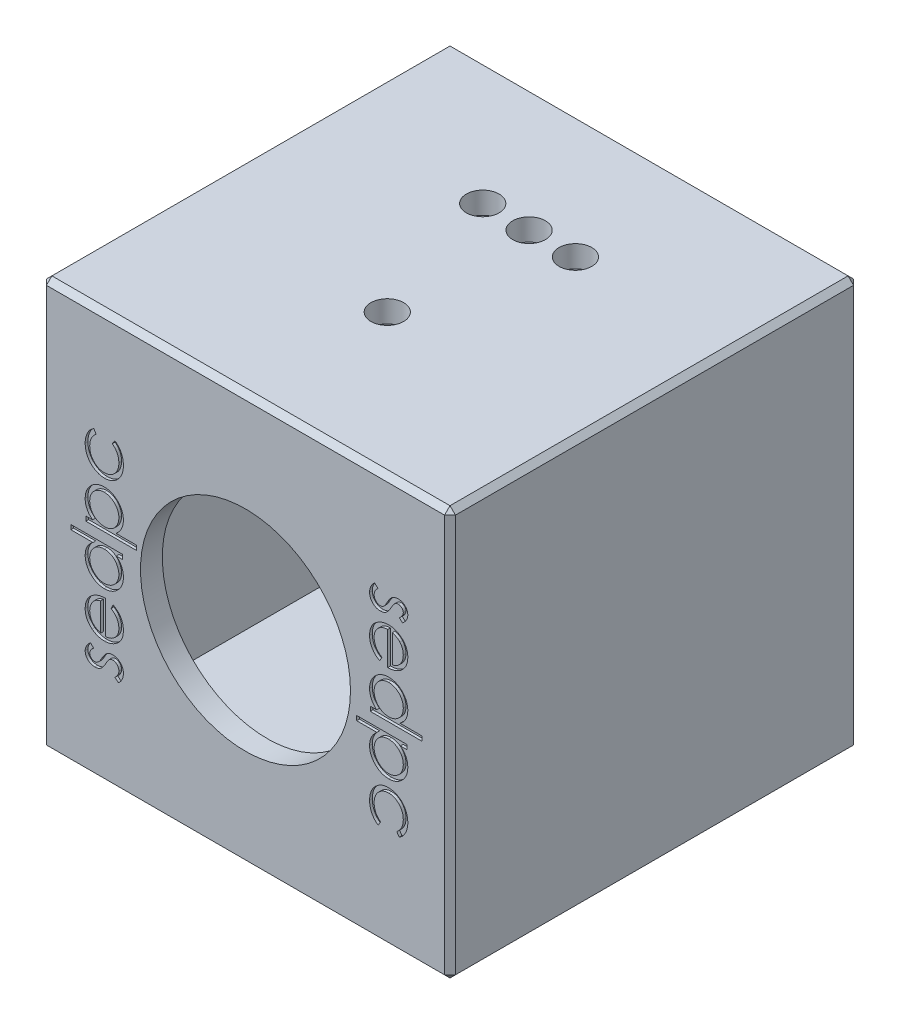
from build123d import *

# Parameters (mm, degrees)
CROQUIS1_W              = 1500
CROQUIS1_H              = 1500
CROQUIS1_W_2            = 1340
CROQUIS1_H_2            = 1340
SALIENTE_EXTRUIR2_DEPTH = 1420
CROQUIS2_W              = 1500
CROQUIS2_H              = 1500
SALIENTE_EXTRUIR3_DEPTH = 80
CROQUIS3_W              = 300
CROQUIS3_H              = 300
CORTAR_EXTRUIR1_DEPTH   = 80
CROQUIS4_W              = 1500
CROQUIS4_H              = 1500
CROQUIS4_R              = 385
SALIENTE_EXTRUIR4_DEPTH = 80
CORTAR_EXTRUIR2_REACH   = 2252
CROQUIS5_R              = 60
CHAFL_N1_SIZE           = 20
CORTAR_EXTRUIR3_DEPTH   = 10
CORTAR_EXTRUIR4_DEPTH   = 10


with BuildPart() as part:
    # Croquis1 → Saliente-Extruir2 (new body)
    with BuildSketch(Plane.XY):
        Rectangle(CROQUIS1_W, CROQUIS1_H)
        Rectangle(CROQUIS1_W_2, CROQUIS1_H_2, mode=Mode.SUBTRACT)
    extrude(amount=SALIENTE_EXTRUIR2_DEPTH)

    # Croquis2 → Saliente-Extruir3 (add)
    with BuildSketch(Plane(origin=(0, 0, 0), x_dir=(-1, 0, 0), z_dir=(0, 0, -1))):
        Rectangle(CROQUIS2_W, CROQUIS2_H)
    extrude(amount=-SALIENTE_EXTRUIR3_DEPTH)

    # Croquis3 → Cortar-Extruir1 (cut)
    with BuildSketch(Plane(origin=(0, 0, 0), x_dir=(-1, 0, 0), z_dir=(0, 0, -1))):
        Rectangle(CROQUIS3_W, CROQUIS3_H)
    extrude(amount=-CORTAR_EXTRUIR1_DEPTH, mode=Mode.SUBTRACT)

    # Croquis4 → Saliente-Extruir4 (add)
    with BuildSketch(Plane.XY.offset(1420)):
        Rectangle(CROQUIS4_W, CROQUIS4_H)
        Circle(CROQUIS4_R, mode=Mode.SUBTRACT)
    extrude(amount=SALIENTE_EXTRUIR4_DEPTH)

    # Cortar-Extruir2: up to this face of the body (flat: up to its plane)
    cortar_extruir2_end = Plane(part.part.faces().sort_by_distance((0, 750, 750))[0])
    # Croquis5 → Cortar-Extruir2 (cut, up to the picked face)
    with BuildSketch(Plane.XZ.offset(750), mode=Mode.PRIVATE) as cortar_extruir2_sk1:
        with Locations(Location((0, 460, 0), (0, 0, 270))):
            Circle(CROQUIS5_R)
    cortar_extruir2_tool1 = split(extrude(cortar_extruir2_sk1.sketch, amount=-CORTAR_EXTRUIR2_REACH, mode=Mode.PRIVATE), bisect_by=cortar_extruir2_end, keep=Keep.BOTH, mode=Mode.PRIVATE)
    # Croquis5 → Cortar-Extruir2 (cut, up to the picked face)
    with BuildSketch(Plane.XZ.offset(750), mode=Mode.PRIVATE) as cortar_extruir2_sk2:
        with Locations(Location((-170, 460, 0), (0, 0, 270))):
            Circle(CROQUIS5_R)
    cortar_extruir2_tool2 = split(extrude(cortar_extruir2_sk2.sketch, amount=-CORTAR_EXTRUIR2_REACH, mode=Mode.PRIVATE), bisect_by=cortar_extruir2_end, keep=Keep.BOTH, mode=Mode.PRIVATE)
    # Croquis5 → Cortar-Extruir2 (cut, up to the picked face)
    with BuildSketch(Plane.XZ.offset(750), mode=Mode.PRIVATE) as cortar_extruir2_sk3:
        with Locations(Location((170, 460, 0), (0, 0, 270))):
            Circle(CROQUIS5_R)
    cortar_extruir2_tool3 = split(extrude(cortar_extruir2_sk3.sketch, amount=-CORTAR_EXTRUIR2_REACH, mode=Mode.PRIVATE), bisect_by=cortar_extruir2_end, keep=Keep.BOTH, mode=Mode.PRIVATE)
    # Croquis5 → Cortar-Extruir2 (cut, up to the picked face)
    with BuildSketch(Plane.XZ.offset(750), mode=Mode.PRIVATE) as cortar_extruir2_sk4:
        with Locations(Location((0, 980, 0), (0, 0, 270))):
            Circle(CROQUIS5_R)
    cortar_extruir2_tool4 = split(extrude(cortar_extruir2_sk4.sketch, amount=-CORTAR_EXTRUIR2_REACH, mode=Mode.PRIVATE), bisect_by=cortar_extruir2_end, keep=Keep.BOTH, mode=Mode.PRIVATE)
    add(cortar_extruir2_tool1.solids().sort_by(Axis((0, -750, 460), (0, 1, 0)))[0], mode=Mode.SUBTRACT)
    add(cortar_extruir2_tool2.solids().sort_by(Axis((-170, -750, 460), (0, 1, 0)))[0], mode=Mode.SUBTRACT)
    add(cortar_extruir2_tool3.solids().sort_by(Axis((170, -750, 460), (0, 1, 0)))[0], mode=Mode.SUBTRACT)
    add(cortar_extruir2_tool4.solids().sort_by(Axis((0, -750, 980), (0, 1, 0)))[0], mode=Mode.SUBTRACT)

    # Chaflán1
    chafl_n1_edges = [part.edges().sort_by_distance(p)[0] for p in [
        (0, -750, 0),
        (-750, 0, 0),
        (0, 750, 0),
        (750, 0, 0),
        (-750, 0, 1500),
        (0, -750, 1500),
        (750, 0, 1500),
        (0, 750, 1500),
        (750, -750, 750),
        (-750, -750, 750),
        (-750, 750, 750),
        (750, 750, 750),
    ]]
    chamfer(chafl_n1_edges, length=CHAFL_N1_SIZE)

    # Croquis6 → Cortar-Extruir3 (cut)
    # profile 1 of 5: a face of its own
    with BuildSketch(Plane.XY.offset(1500)):
        with BuildLine():
            Line((-568.633077748, -324.415554622), (-557.020455886, -335.694267229))
            add(Edge.make_bspline(
                [(-557.020455886, -335.694267229), (-558.148276546, -336.667431374), (-560.322582007, -338.54357728), (-563.229668443, -341.519159817), (-565.671081462, -344.483742173), (-567.732305163, -347.396741891), (-569.290655837, -350.331408629), (-570.428092282, -353.253303881), (-571.131979498, -356.16545296), (-571.222701879, -358.112047324), (-571.267250758, -359.067915066)],
                knots=[0, 0, 0, 0, 1.26578478, 2.440284043, 3.530471711, 4.527705817, 5.468200915, 6.346673037, 7.188140097, 8, 8, 8, 8], degree=3))
            add(Edge.make_bspline(
                [(-571.267250758, -359.067915066), (-571.210224233, -360.239330502), (-571.098004104, -362.544510298), (-569.982893306, -365.849720318), (-568.263604129, -368.901893021), (-565.871754887, -371.579831622), (-563.070788574, -373.827640144), (-559.927721609, -375.449616895), (-556.562939154, -376.463457008), (-554.232579754, -376.589748674), (-553.050645857, -376.653802485)],
                knots=[0, 0, 0, 0, 0.999370852, 1.966620401, 2.952450547, 3.979894107, 5.019529251, 6.00881856, 6.990093614, 8, 8, 8, 8], degree=3))
            add(Edge.make_bspline(
                [(-553.050645857, -376.653802485), (-551.981091854, -376.595022003), (-549.844998906, -376.47762674), (-546.693915449, -375.564989965), (-543.621730511, -374.111576979), (-541.73986005, -372.753195865), (-540.770205485, -372.053274975)],
                knots=[0, 0, 0, 0, 0.960159726, 1.917612774, 2.927026955, 4, 4, 4, 4], degree=3))
            add(Edge.make_bspline(
                [(-540.770205485, -372.053274975), (-540.254731267, -371.62970575), (-539.15096621, -370.72273331), (-537.580158282, -369.077648725), (-535.93766306, -367.128878914), (-534.23462374, -364.857922081), (-532.469256276, -362.260213641), (-530.61157242, -359.373822848), (-528.715951129, -356.16307605), (-527.469639427, -353.901886329), (-526.82021884, -352.723639224)],
                knots=[0, 0, 0, 0, 0.667332049, 1.428932371, 2.272176193, 3.217953793, 4.268659351, 5.415594948, 6.6533338, 8, 8, 8, 8], degree=3))
            add(Edge.make_bspline(
                [(-526.82021884, -352.723639224), (-526.013848635, -351.283329697), (-524.456206921, -348.501125956), (-522.032836509, -344.552102216), (-519.640370327, -340.946979419), (-517.224107454, -337.735534906), (-514.883439675, -334.842466566), (-512.553660538, -332.314263142), (-510.228612199, -330.143094298), (-508.601988984, -328.928715058), (-507.824492344, -328.348263623)],
                knots=[0, 0, 0, 0, 1.271974443, 2.457035787, 3.569878245, 4.604907449, 5.553098313, 6.436573686, 7.252710343, 8, 8, 8, 8], degree=3))
            add(Edge.make_bspline(
                [(-507.824492344, -328.348263623), (-506.255177764, -327.38318607), (-503.1221285, -325.45646242), (-497.96907784, -323.46689498), (-492.51874945, -322.280384586), (-488.797736484, -322.121924875), (-486.899512377, -322.04108881)],
                knots=[0, 0, 0, 0, 0.995432674, 1.98732596, 2.973261739, 4, 4, 4, 4], degree=3))
            add(Edge.make_bspline(
                [(-486.899512377, -322.04108881), (-485.562355687, -322.079167229), (-482.927342359, -322.154204914), (-479.046674616, -322.675816637), (-475.335508946, -323.573180396), (-471.752856124, -324.794628656), (-468.370031029, -326.447042609), (-465.100145248, -328.36761401), (-462.041979132, -330.714069015), (-459.142132637, -333.35032356), (-456.489793325, -336.252627659), (-454.169122039, -339.360942184), (-452.183095684, -342.631711436), (-450.591337836, -346.11234341), (-449.314341646, -349.75965442), (-448.433546172, -353.591972482), (-447.905567684, -357.593843261), (-447.832340808, -360.315358114), (-447.795028536, -361.702088076)],
                knots=[0, 0, 0, 0, 1.03294705, 2.035535002, 3.018074688, 3.978914202, 4.953244146, 5.921606783, 6.903774788, 7.924990491, 8.946206195, 9.936011882, 10.917482605, 11.896392379, 12.887442265, 13.897874922, 14.928876017, 16, 16, 16, 16], degree=3))
            add(Edge.make_bspline(
                [(-447.795028536, -361.702088076), (-447.847321002, -363.573693986), (-447.951179336, -367.2909), (-448.933969531, -372.787027034), (-450.445564009, -378.168911496), (-452.600682392, -383.359225011), (-455.250202884, -388.278677167), (-458.385015892, -392.806325713), (-461.98855081, -396.895063531), (-464.744807951, -399.23066158), (-466.122936522, -400.398460605)],
                knots=[0, 0, 0, 0, 1.014105853, 2.01412079, 3.018242674, 4.040740662, 5.055023907, 6.042888753, 7.021444376, 8, 8, 8, 8], degree=3))
            Line((-466.122936522, -400.398460605), (-478.663084091, -389.379455196))
            add(Edge.make_bspline(
                [(-478.663084091, -389.379455196), (-477.533061135, -388.33316501), (-475.342340771, -386.30477328), (-472.42534441, -383.060917225), (-469.980527146, -379.76000725), (-467.935646447, -376.435005085), (-466.360031363, -373.036691761), (-465.253089102, -369.584111341), (-464.541667264, -366.084286401), (-464.458149824, -363.733615047), (-464.416289219, -362.555411727)],
                knots=[0, 0, 0, 0, 1.179806542, 2.287233372, 3.337373186, 4.324005949, 5.273901747, 6.200048787, 7.097828587, 8, 8, 8, 8], degree=3))
            add(Edge.make_bspline(
                [(-464.416289219, -362.555411727), (-464.488835163, -360.951100007), (-464.630577768, -357.816544025), (-465.91726633, -353.326728274), (-467.935316741, -349.181934305), (-470.796001927, -345.579985026), (-474.124198114, -342.531806741), (-477.859504201, -340.280128738), (-481.935148311, -338.915774008), (-484.762201667, -338.747572587), (-486.194592839, -338.662349494)],
                knots=[0, 0, 0, 0, 1.072236613, 2.094970478, 3.102399718, 4.141104368, 5.155589565, 6.110053346, 7.042415349, 8, 8, 8, 8], degree=3))
            add(Edge.make_bspline(
                [(-486.194592839, -338.662349494), (-487.375669463, -338.71805782), (-489.695548497, -338.827480507), (-493.061265908, -339.74041108), (-496.272199278, -341.121211781), (-498.152652146, -342.517880908), (-499.105750691, -343.225775976)],
                knots=[0, 0, 0, 0, 1.014054094, 1.991812201, 2.982159616, 4, 4, 4, 4], degree=3))
            add(Edge.make_bspline(
                [(-499.105750691, -343.225775976), (-499.584003048, -343.650202478), (-500.625809409, -344.574756685), (-502.127399591, -346.272814206), (-503.756244081, -348.289810955), (-505.413805832, -350.715333178), (-507.250057158, -353.427005749), (-509.071026467, -356.569659853), (-511.057044125, -360.021492466), (-512.369614106, -362.465225502), (-513.055737336, -363.742644633)],
                knots=[0, 0, 0, 0, 0.615029206, 1.339755737, 2.178261527, 3.109653826, 4.166232585, 5.329982127, 6.604294388, 8, 8, 8, 8], degree=3))
            add(Edge.make_bspline(
                [(-513.055737336, -363.742644633), (-513.82509972, -365.120946002), (-515.317138915, -367.793912223), (-517.641031495, -371.579956369), (-520.004674781, -374.995587196), (-522.275479191, -378.1229926), (-524.573170808, -380.88317915), (-526.900300365, -383.265273082), (-529.163016295, -385.363059919), (-530.766248241, -386.52444379), (-531.532049436, -387.079191441)],
                knots=[0, 0, 0, 0, 1.262093308, 2.447601706, 3.550203992, 4.582594899, 5.537233252, 6.418365656, 7.244515135, 8, 8, 8, 8], degree=3))
            add(Edge.make_bspline(
                [(-531.532049436, -387.079191441), (-533.074820005, -388.037211904), (-536.151058356, -389.94747604), (-541.292044671, -391.835216732), (-546.718962152, -393.096998465), (-550.470772891, -393.214950614), (-552.382827347, -393.275063169)],
                knots=[0, 0, 0, 0, 0.984940175, 1.963941237, 2.962352981, 4, 4, 4, 4], degree=3))
            add(Edge.make_bspline(
                [(-552.382827347, -393.275063169), (-553.633021147, -393.246832829), (-556.079827538, -393.191582055), (-559.67469121, -392.749514641), (-563.091211866, -391.947546858), (-566.386506015, -390.928899603), (-569.503154369, -389.546594947), (-572.455567336, -387.860456777), (-575.24696016, -385.894264249), (-577.839559044, -383.626563085), (-580.19598007, -381.134476202), (-582.245144176, -378.439376986), (-584.008488162, -375.617770621), (-585.422998924, -372.612470562), (-586.546564996, -369.458800236), (-587.307753939, -366.133018511), (-587.819728521, -362.657898267), (-587.86525361, -360.281809791), (-587.888511442, -359.067915066)],
                knots=[0, 0, 0, 0, 1.087304385, 2.128008728, 3.143103065, 4.136477636, 5.123835063, 6.101831209, 7.089715868, 8.088492253, 9.092987035, 10.067605355, 11.028834439, 11.98153898, 12.951158004, 13.934816901, 14.944940436, 16, 16, 16, 16], degree=3))
            add(Edge.make_bspline(
                [(-587.888511442, -359.067915066), (-587.830073413, -357.629001707), (-587.712101119, -354.72418247), (-586.775174991, -350.366250174), (-585.233548233, -346.014735822), (-583.104380885, -341.658458553), (-580.34917537, -337.32933074), (-577.019166612, -332.989272074), (-573.136262552, -328.586180471), (-570.16767854, -325.83682557), (-568.633077748, -324.415554622)],
                knots=[0, 0, 0, 0, 0.845714091, 1.707292901, 2.609013841, 3.555613372, 4.552488639, 5.621697636, 6.770543573, 8, 8, 8, 8], degree=3))
        make_face()
    # profile 2 of 5: a face of its own
    with BuildSketch(Plane.XY.offset(1500)):
        with BuildLine():
            Line((-492.909878963, -177.718088677), (-485.155764046, -162.951879409))
            add(Edge.make_bspline(
                [(-485.155764046, -162.951879409), (-483.069049207, -164.129183222), (-479.009128486, -166.419750221), (-473.430972637, -170.34282904), (-468.442648924, -174.493002096), (-464.124034754, -178.996542634), (-460.310162192, -183.71773994), (-457.020483829, -188.746264232), (-454.195642001, -194.041070741), (-451.880947708, -199.660479115), (-450.06123462, -205.597757869), (-448.717364084, -211.887359283), (-447.938046869, -218.558980538), (-447.84346119, -223.127697737), (-447.795028536, -225.467112114)],
                knots=[0, 0, 0, 0, 1.120611642, 2.180266485, 3.186550691, 4.152466804, 5.095166165, 6.022949561, 6.960161436, 7.899497276, 8.862391909, 9.862399089, 10.905440174, 12, 12, 12, 12], degree=3))
            add(Edge.make_bspline(
                [(-447.795028536, -225.467112114), (-447.855733232, -228.067541754), (-447.974150508, -233.140226634), (-448.995043393, -240.524204979), (-450.660455795, -247.476365653), (-452.986965387, -253.996319061), (-456.025829081, -260.068093804), (-459.72784747, -265.703774396), (-464.074028488, -270.932935066), (-469.101921681, -275.591031798), (-474.482815558, -279.783801112), (-480.088839442, -283.486040561), (-485.900579084, -286.566834544), (-491.883455881, -289.111172629), (-498.023874358, -291.118173233), (-504.357001415, -292.544378802), (-510.857724363, -293.358932911), (-515.254866975, -293.484314409), (-517.470759706, -293.547499067)],
                knots=[0, 0, 0, 0, 1.14524686, 2.234044844, 3.276713788, 4.290115724, 5.276966211, 6.260758605, 7.254862358, 8.264742877, 9.274005885, 10.257798278, 11.220590477, 12.167824544, 13.118936889, 14.062732937, 15.023735098, 16, 16, 16, 16], degree=3))
            add(Edge.make_bspline(
                [(-517.470759706, -293.547499067), (-519.550111148, -293.491452838), (-523.671111113, -293.380376614), (-529.770579511, -292.680247448), (-535.698751791, -291.439441939), (-541.460553829, -289.736778131), (-547.046338419, -287.538024687), (-552.459505119, -284.848153086), (-557.69429377, -281.662973095), (-560.996459596, -279.203794109), (-562.65981219, -277.965067176)],
                knots=[0, 0, 0, 0, 1.024358464, 2.0301432, 3.019427413, 4.004406732, 4.986367066, 5.972626655, 6.978780325, 8, 8, 8, 8], degree=3))
            add(Edge.make_bspline(
                [(-562.65981219, -277.965067176), (-564.667029144, -276.290094907), (-568.611432023, -272.998589509), (-573.746985187, -267.373719267), (-578.140011909, -261.365043411), (-581.723851794, -254.91212186), (-584.480391297, -248.025824203), (-586.44108139, -240.741669432), (-587.661112324, -233.039524341), (-587.811559305, -227.75961962), (-587.888511442, -225.059000803)],
                knots=[0, 0, 0, 0, 1.030811313, 2.025658015, 2.997072178, 3.962767568, 4.930766827, 5.917075773, 6.934604948, 8, 8, 8, 8], degree=3))
            add(Edge.make_bspline(
                [(-587.888511442, -225.059000803), (-587.81721855, -222.283488771), (-587.677358148, -216.838566854), (-586.369144289, -208.901621897), (-584.319748685, -201.376771023), (-581.333876584, -194.326112997), (-577.63268417, -187.641007544), (-572.954550259, -181.475311635), (-567.539749328, -175.659772893), (-563.371196239, -172.278298155), (-561.249973114, -170.557590212)],
                knots=[0, 0, 0, 0, 1.056389096, 2.072394598, 3.055233004, 4.020130009, 4.981825462, 5.957811105, 6.960805292, 8, 8, 8, 8], degree=3))
            add(Edge.make_bspline(
                [(-561.249973114, -170.557590212), (-559.651700265, -169.386706393), (-556.465793151, -167.052732509), (-551.270902755, -164.129240132), (-545.83580047, -161.591494647), (-540.072630583, -159.563042127), (-534.049677799, -157.920535189), (-527.723884808, -156.732195197), (-521.097135331, -156.03530288), (-516.581938437, -155.898317646), (-514.280071271, -155.828481973)],
                knots=[0, 0, 0, 0, 0.94817472, 1.890038105, 2.849395472, 3.817997239, 4.812318967, 5.836947057, 6.897266129, 8, 8, 8, 8], degree=3))
            Line((-514.280071271, -155.828481973), (-514.280071271, -276.926238383))
            add(Edge.make_bspline(
                [(-514.280071271, -276.926238383), (-512.496755038, -276.844767543), (-508.989935589, -276.684558421), (-503.858564984, -275.937632095), (-498.970475628, -274.76030115), (-494.362331324, -273.105646585), (-489.97394541, -271.101859357), (-485.837870953, -268.647281844), (-481.972947155, -265.718897114), (-478.34460279, -262.452578855), (-475.113470845, -258.816828393), (-472.22148102, -254.991866353), (-469.797601526, -250.922915205), (-467.830165693, -246.642058287), (-466.289956468, -242.15621799), (-465.238617624, -237.463980999), (-464.534449885, -232.574580675), (-464.456150935, -229.241585582), (-464.416289219, -227.5447697)],
                knots=[0, 0, 0, 0, 1.094153842, 2.151609401, 3.174256925, 4.172055639, 5.149267565, 6.128595816, 7.11444997, 8.118368179, 9.117203808, 10.09244225, 11.054858984, 12.015122123, 12.976791628, 13.957293641, 14.960065497, 16, 16, 16, 16], degree=3))
            add(Edge.make_bspline(
                [(-464.416289219, -227.5447697), (-464.448206446, -225.885699087), (-464.511536345, -222.593784731), (-465.136166775, -217.692605657), (-466.12615179, -212.862328916), (-467.552031314, -208.150917843), (-469.221717007, -203.627035356), (-471.186926288, -199.414529052), (-473.427487309, -195.569090396), (-475.973604266, -191.961002654), (-479.098358471, -188.480281539), (-482.960281547, -184.972726244), (-487.603175533, -181.294714987), (-491.074412389, -178.955161396), (-492.909878963, -177.718088677)],
                knots=[0, 0, 0, 0, 0.991168677, 1.966668791, 2.94808785, 3.9350306, 4.905702032, 5.828266021, 6.709360349, 7.562606342, 8.463112863, 9.498839253, 10.677475166, 12, 12, 12, 12], degree=3))
        make_face()
        with BuildLine():
            add(Edge.make_bspline(
                [(-530.901331954, -172.449742656), (-533.107094083, -173.055642095), (-537.341440768, -174.218772175), (-543.202938454, -176.695859794), (-548.4423116, -179.418319066), (-552.972493498, -182.695624326), (-557.002342581, -186.372635101), (-560.467673768, -190.678503616), (-563.661603108, -195.426479423), (-566.321385887, -200.711132609), (-568.507087108, -206.324062778), (-570.114253157, -212.149902072), (-571.058993512, -218.139853741), (-571.197505353, -222.174231349), (-571.267250758, -224.205677152)],
                knots=[0, 0, 0, 0, 1.155085888, 2.217389643, 3.210301801, 4.133263417, 5.03575695, 5.95948047, 6.920061569, 7.923798377, 8.943125483, 9.960783337, 10.973185325, 12, 12, 12, 12], degree=3))
            add(Edge.make_bspline(
                [(-571.267250758, -224.205677152), (-571.235260579, -225.864711707), (-571.172022721, -229.144274227), (-570.55960833, -233.97379085), (-569.57552641, -238.623860528), (-568.128585457, -243.080603055), (-566.367944286, -247.373581602), (-564.203760037, -251.499694166), (-561.587223414, -255.405898828), (-559.58846476, -257.847271213), (-558.578699075, -259.080643765)],
                knots=[0, 0, 0, 0, 1.048823158, 2.073302879, 3.073550078, 4.050623576, 5.03253758, 6.005186856, 6.992227572, 8, 8, 8, 8], degree=3))
            add(Edge.make_bspline(
                [(-558.578699075, -259.080643765), (-557.780042159, -259.964135044), (-556.163755207, -261.75210607), (-553.37748271, -264.138631202), (-550.371257818, -266.440685588), (-547.013856046, -268.486396342), (-543.402638406, -270.430540728), (-539.51125473, -272.202160335), (-535.323279399, -273.812998921), (-532.403511701, -274.717260226), (-530.901331954, -275.182490052)],
                knots=[0, 0, 0, 0, 0.879905587, 1.780714457, 2.708106151, 3.677566983, 4.684151534, 5.740052498, 6.837288539, 8, 8, 8, 8], degree=3))
            Line((-530.901331954, -275.182490052), (-530.901331954, -172.449742656))
        make_face(mode=Mode.SUBTRACT)
    # profile 3 of 5: a face of its own
    with BuildSketch(Plane.XY.offset(1500)):
        with BuildLine():
            Line((-640.126759305, 15.133056489), (-450.169494348, 15.133056489))
            Line((-450.169494348, 15.133056489), (-450.169494348, -1.488204195))
            Line((-450.169494348, -1.488204195), (-473.580243213, -1.488204195))
            add(Edge.make_bspline(
                [(-473.580243213, -1.488204195), (-471.464972517, -3.365374538), (-467.330856413, -7.034143817), (-461.880398221, -13.103940333), (-457.467022908, -19.617906393), (-453.850796587, -26.412587431), (-451.145385311, -33.554539082), (-449.21900532, -41.006432623), (-447.981339084, -48.775387451), (-447.85768922, -54.080382355), (-447.795028536, -56.76873638)],
                knots=[0, 0, 0, 0, 1.074325654, 2.099677833, 3.090439787, 4.057542011, 5.018572219, 5.985274637, 6.979019747, 8, 8, 8, 8], degree=3))
            add(Edge.make_bspline(
                [(-447.795028536, -56.76873638), (-447.859924068, -59.158873937), (-447.987900932, -63.872331029), (-448.980739498, -70.805953027), (-450.57515156, -77.478334561), (-452.792406963, -83.895780697), (-455.733558774, -90.01676506), (-459.254699816, -95.893695176), (-463.447860408, -101.496125128), (-468.241476909, -106.738660732), (-473.448211647, -111.566354085), (-479.001580169, -115.802929761), (-484.87756875, -119.335280237), (-491.001781477, -122.289092841), (-497.421362635, -124.564316068), (-504.114112772, -126.15042088), (-511.07211858, -127.142102852), (-515.810251678, -127.270026813), (-518.212780272, -127.334892229)],
                knots=[0, 0, 0, 0, 1.033919861, 2.038935746, 3.024066025, 3.998881131, 4.97069526, 5.957263378, 6.95902576, 7.993208707, 9.027059324, 10.027763471, 11.009749337, 11.988697705, 12.965288445, 13.950418724, 14.960734635, 16, 16, 16, 16], degree=3))
            add(Edge.make_bspline(
                [(-518.212780272, -127.334892229), (-520.565651252, -127.26858916), (-525.217150253, -127.137511569), (-532.058148021, -126.161028686), (-538.647239319, -124.518971144), (-544.963210897, -122.214564205), (-551.013705218, -119.259594089), (-556.803001542, -115.66506615), (-562.347048824, -111.430720802), (-567.515484576, -106.54903093), (-572.289658748, -101.260816009), (-576.438804069, -95.603562332), (-580.022153986, -89.717997028), (-582.861317107, -83.512829388), (-585.158382223, -77.079903425), (-586.747626785, -70.361950254), (-587.684110034, -63.386920883), (-587.81972297, -58.651382344), (-587.888511442, -56.249321983)],
                knots=[0, 0, 0, 0, 1.020392517, 2.01726096, 2.990465484, 3.961182959, 4.928053699, 5.906110375, 6.912531644, 7.948652711, 8.985773172, 9.998621852, 10.987621588, 11.969261332, 12.953316658, 13.946091881, 14.958173133, 16, 16, 16, 16], degree=3))
            add(Edge.make_bspline(
                [(-587.888511442, -56.249321983), (-587.806643136, -53.485883401), (-587.645944751, -48.061560567), (-586.271254937, -40.137200946), (-584.043936752, -32.621956165), (-580.912334362, -25.499766797), (-576.801999125, -18.833087077), (-571.902069221, -12.511227841), (-566.007664059, -6.6934056), (-561.583684816, -3.24972467), (-559.320719641, -1.488204195)],
                knots=[0, 0, 0, 0, 1.030935089, 2.023611011, 2.991955418, 3.950956655, 4.918431382, 5.908366361, 6.930082213, 8, 8, 8, 8], degree=3))
            Line((-559.320719641, -1.488204195), (-640.126759305, -1.488204195))
            Line((-640.126759305, -1.488204195), (-640.126759305, 15.133056489))
        make_face()
        with BuildLine():
            add(Edge.make_bspline(
                [(-571.267250758, -56.026715813), (-571.180730109, -58.456297238), (-571.009952111, -63.251904529), (-569.678924617, -70.292905811), (-567.458510895, -77.027065824), (-564.439598257, -83.443912884), (-560.571509594, -89.364509112), (-556.01418695, -94.748750148), (-550.690704454, -99.430618839), (-544.791574256, -103.457014603), (-538.432456954, -106.689309987), (-531.787133201, -108.976594209), (-524.970608652, -110.482309967), (-520.347745906, -110.636323584), (-518.02727513, -110.713631545)],
                knots=[0, 0, 0, 0, 1.031130969, 2.035288524, 3.029955243, 4.035265425, 5.037320146, 6.024362013, 7.021230137, 8.037832003, 9.049975902, 10.039737725, 11.016035826, 12, 12, 12, 12], degree=3))
            add(Edge.make_bspline(
                [(-518.02727513, -110.713631545), (-515.720777637, -110.614549363), (-511.116823343, -110.416773367), (-504.300883883, -109.009560744), (-497.670476977, -106.617752629), (-491.260258654, -103.389827993), (-485.3034874, -99.316044624), (-479.884389028, -94.638628692), (-475.25577982, -89.22848269), (-471.378366109, -83.254952548), (-468.248198643, -76.872186695), (-466.069714823, -70.160713728), (-464.663342768, -63.245753661), (-464.499059412, -58.543989843), (-464.416289219, -56.175119927)],
                knots=[0, 0, 0, 0, 0.979154007, 1.954470061, 2.941101473, 3.965068436, 4.993389179, 5.998216918, 6.996159742, 8.005560442, 9.015493761, 10.005250788, 10.994993882, 12, 12, 12, 12], degree=3))
            add(Edge.make_bspline(
                [(-464.416289219, -56.175119927), (-464.505143745, -53.770570165), (-464.681866583, -48.988159176), (-466.005363565, -41.918406404), (-468.274922703, -35.081045904), (-471.324975418, -28.522719304), (-475.123894578, -22.419058376), (-479.57140266, -16.959506888), (-484.708253556, -12.288440448), (-490.419299486, -8.399435834), (-496.640393352, -5.31526516), (-503.257055904, -3.060158972), (-510.282717565, -1.741658235), (-515.090741978, -1.573857046), (-517.544961762, -1.488204195)],
                knots=[0, 0, 0, 0, 1.01787422, 2.024450869, 3.03297362, 4.061474925, 5.080076323, 6.069755756, 7.033548292, 8.009625779, 8.9862229, 9.964937832, 10.961217871, 12, 12, 12, 12], degree=3))
            add(Edge.make_bspline(
                [(-517.544961762, -1.488204195), (-519.41492196, -1.538986011), (-523.095595392, -1.638940696), (-528.499843196, -2.402558334), (-533.671586198, -3.617256523), (-538.616261828, -5.32890802), (-543.306531393, -7.577405153), (-547.776072037, -10.289266098), (-552.001637806, -13.51217948), (-555.925041979, -17.194263815), (-559.50360894, -21.22467245), (-562.697883345, -25.489466892), (-565.321955902, -30.039175585), (-567.493723185, -34.797285455), (-569.221936534, -39.772051904), (-570.374868663, -45.003955536), (-571.166518984, -50.437385261), (-571.233319967, -54.143989025), (-571.267250758, -56.026715813)],
                knots=[0, 0, 0, 0, 1.050140795, 2.067009409, 3.05949893, 4.030605086, 5.00011959, 5.97591094, 6.962425594, 7.979863591, 8.993523472, 9.986985069, 10.967611495, 11.937549037, 12.921786183, 13.919465291, 14.943216303, 16, 16, 16, 16], degree=3))
        make_face(mode=Mode.SUBTRACT)
    # profile 4 of 5: a face of its own
    with BuildSketch(Plane.XY.offset(1500)):
        with BuildLine():
            Line((-585.51404563, 53.12450948), (-585.51404563, 69.745770164))
            Line((-585.51404563, 69.745770164), (-560.470851519, 69.745770164))
            add(Edge.make_bspline(
                [(-560.470851519, 69.745770164), (-562.725484678, 71.516024883), (-567.120821849, 74.967081359), (-572.881707817, 80.825134831), (-577.641919189, 87.119073988), (-581.479893802, 93.809207656), (-584.314203375, 100.938011259), (-586.423546912, 108.403576588), (-587.66280123, 116.290946782), (-587.812279256, 121.682865372), (-587.888511442, 124.432685896)],
                knots=[0, 0, 0, 0, 1.07939028, 2.104237756, 3.085658289, 4.045737152, 5.001099604, 5.968961907, 6.964192404, 8, 8, 8, 8], degree=3))
            add(Edge.make_bspline(
                [(-587.888511442, 124.432685896), (-587.819022392, 126.834658232), (-587.681673635, 131.582282738), (-586.751766164, 138.570628602), (-585.158038273, 145.30032598), (-582.861406501, 151.733302169), (-580.022137884, 157.938472702), (-576.438778085, 163.823975485), (-572.289783822, 169.481484471), (-567.514999174, 174.768716144), (-562.348836743, 179.654055176), (-556.791406483, 183.879248926), (-551.025469619, 187.52372053), (-544.961638072, 190.469607051), (-538.64766216, 192.777215435), (-532.058032162, 194.418408793), (-525.217180313, 195.395125761), (-520.56566135, 195.526171328), (-518.212780272, 195.592458198)],
                knots=[0, 0, 0, 0, 1.041296284, 2.058176809, 3.050446431, 4.034000596, 5.01514041, 6.003636468, 7.015969324, 8.052561599, 9.08815499, 10.094063707, 11.074456064, 12.040834395, 13.011057502, 13.983766392, 14.980127149, 16, 16, 16, 16], degree=3))
            add(Edge.make_bspline(
                [(-518.212780272, 195.592458198), (-515.810241444, 195.527609587), (-511.072088165, 195.399718768), (-504.11422927, 194.407795537), (-497.420939071, 192.822577615), (-491.003350541, 190.544082091), (-484.865882326, 187.599719999), (-479.012960535, 184.017020346), (-473.44646041, 179.789694795), (-468.24195278, 174.958343454), (-463.447739139, 169.716792254), (-459.254724622, 164.114108435), (-455.733576846, 158.237240292), (-452.792311903, 152.116254781), (-450.575517162, 145.698752243), (-448.976491879, 139.014674631), (-447.99041648, 132.067661046), (-447.860657276, 127.342141753), (-447.795028536, 124.952100292)],
                knots=[0, 0, 0, 0, 1.038740735, 2.04854663, 3.033179607, 4.009277356, 4.987731542, 5.972001279, 6.972200261, 8.005528982, 9.039189865, 10.040446548, 11.026516639, 11.997840187, 12.972163198, 13.956796175, 14.96660207, 16, 16, 16, 16], degree=3))
            add(Edge.make_bspline(
                [(-447.795028536, 124.952100292), (-447.868886385, 122.263489909), (-448.014721929, 116.954711488), (-449.309106721, 109.170648672), (-451.434974743, 101.713002763), (-454.416304862, 94.603685417), (-458.245315247, 87.82289528), (-462.906295899, 81.39737037), (-468.398438468, 75.295300534), (-472.564605611, 71.62240539), (-474.693274062, 69.745770164)],
                knots=[0, 0, 0, 0, 1.014661154, 2.003492687, 2.970165371, 3.937187664, 4.907406957, 5.904113462, 6.929124205, 8, 8, 8, 8], degree=3))
            Line((-474.693274062, 69.745770164), (-400.305712296, 69.745770164))
            Line((-400.305712296, 69.745770164), (-400.305712296, 53.12450948))
            Line((-400.305712296, 53.12450948), (-585.51404563, 53.12450948))
        make_face()
        with BuildLine():
            add(Edge.make_bspline(
                [(-571.267250758, 124.284281783), (-571.233370428, 122.401529934), (-571.16666879, 118.694876832), (-570.374297333, 113.261805244), (-569.224008528, 108.028588859), (-567.482420474, 103.04796893), (-565.344649943, 98.272207141), (-562.673310184, 93.738086756), (-559.516724875, 89.448790472), (-555.935359593, 85.415110115), (-551.98911568, 81.771094168), (-547.777594114, 78.54513923), (-543.306128392, 75.835419336), (-538.616369626, 73.586354097), (-533.67155662, 71.874855389), (-528.499851366, 70.660115217), (-523.09559325, 69.896509047), (-519.414921238, 69.796552783), (-517.544961762, 69.745770164)],
                knots=[0, 0, 0, 0, 1.05670511, 2.080379991, 3.077984906, 4.06214886, 5.038337365, 6.01289324, 7.01187578, 8.025460281, 9.038092164, 10.024533457, 11.000252242, 11.969694649, 12.940728589, 13.933144304, 14.949937299, 16, 16, 16, 16], degree=3))
            add(Edge.make_bspline(
                [(-517.544961762, 69.745770164), (-515.090351189, 69.830306863), (-510.281561188, 69.995921415), (-503.265316053, 71.32947716), (-496.631746228, 73.524157959), (-490.424021157, 76.627071336), (-484.68063085, 80.503039808), (-479.597678634, 85.257776439), (-475.108580649, 90.714493988), (-471.327481654, 96.857906842), (-468.272753853, 103.449794535), (-466.016751992, 110.302660436), (-464.677714364, 117.368414363), (-464.503902807, 122.139178843), (-464.416289219, 124.543988981)],
                knots=[0, 0, 0, 0, 1.037533453, 2.032615907, 3.008487753, 3.983910949, 4.958815134, 5.928528047, 6.917017829, 7.938835504, 8.970843303, 9.983125212, 10.983349323, 12, 12, 12, 12], degree=3))
            add(Edge.make_bspline(
                [(-464.416289219, 124.543988981), (-464.498649892, 126.90067061), (-464.66212102, 131.57825997), (-466.07698147, 138.465834557), (-468.238499153, 145.159141909), (-471.389678393, 151.519267818), (-475.253993779, 157.487294428), (-479.886330624, 162.893804151), (-485.29214683, 167.577533338), (-491.271406323, 171.607765651), (-497.677176957, 174.829773017), (-504.293025985, 177.277250919), (-511.117759477, 178.671598887), (-515.72109009, 178.871200654), (-518.02727513, 178.971197515)],
                knots=[0, 0, 0, 0, 1.001123591, 1.987050352, 2.978152323, 3.984730168, 4.995502505, 5.994801396, 7.000994558, 8.027767845, 9.053126238, 10.042874082, 11.019515457, 12, 12, 12, 12], degree=3))
            add(Edge.make_bspline(
                [(-518.02727513, 178.971197515), (-520.347895429, 178.894165588), (-524.971056055, 178.74070189), (-531.785349662, 177.230867574), (-538.444634554, 174.957720903), (-544.768923721, 171.663676221), (-550.703760132, 167.695833669), (-556.012128465, 163.003095028), (-560.572068116, 157.622949049), (-564.439447058, 151.701242258), (-567.458550957, 145.284694482), (-569.678913878, 138.550454976), (-571.009954891, 131.509474848), (-571.180731044, 126.71386467), (-571.267250758, 124.284281783)],
                knots=[0, 0, 0, 0, 0.984010603, 1.960354772, 2.950163297, 3.964735994, 4.97843856, 5.975353722, 6.962442164, 7.964544167, 8.969901786, 9.964615439, 10.968820376, 12, 12, 12, 12], degree=3))
        make_face(mode=Mode.SUBTRACT)
    # profile 5 of 5: a face of its own
    with BuildSketch(Plane.XY.offset(1500)):
        with BuildLine():
            Line((-556.167132235, 361.805065036), (-547.522592638, 347.892179419))
            add(Edge.make_bspline(
                [(-547.522592638, 347.892179419), (-549.418511812, 346.366599043), (-553.150306816, 343.363753086), (-557.966249118, 338.149385163), (-562.102588412, 332.59253116), (-565.473578566, 326.598234469), (-568.078213648, 320.174902549), (-569.921312023, 313.347866671), (-571.069828206, 306.118100369), (-571.20036499, 301.161650254), (-571.267250758, 298.622013821)],
                knots=[0, 0, 0, 0, 1.026593902, 2.0206758, 2.988051866, 3.946915611, 4.916868779, 5.907761954, 6.927957743, 8, 8, 8, 8], degree=3))
            add(Edge.make_bspline(
                [(-571.267250758, 298.622013821), (-571.211326191, 296.592185684), (-571.101184277, 292.594494361), (-570.412712337, 286.725710408), (-569.161656064, 281.135469221), (-567.513251273, 275.788731709), (-565.303965097, 270.723526228), (-562.615282169, 265.926581794), (-559.490550869, 261.355349614), (-555.870492842, 257.142297052), (-551.933563345, 253.28842876), (-547.713263632, 249.949444559), (-543.336002723, 247.042365178), (-538.69247303, 244.761341655), (-533.888906878, 242.894697217), (-528.834632015, 241.66667494), (-523.594399948, 240.848334808), (-520.02155447, 240.754707835), (-518.212780272, 240.707308626)],
                knots=[0, 0, 0, 0, 1.112346261, 2.190735716, 3.231507886, 4.247384806, 5.251966152, 6.253067467, 7.256802811, 8.280671706, 9.291813951, 10.270744147, 11.225547591, 12.165006084, 13.100104208, 14.043489273, 15.009504848, 16, 16, 16, 16], degree=3))
            add(Edge.make_bspline(
                [(-518.212780272, 240.707308626), (-515.84408142, 240.802887673), (-511.126478656, 240.993247025), (-504.174511093, 242.441077417), (-497.465504558, 244.863679047), (-491.035729148, 248.136501507), (-485.078139379, 252.290809876), (-479.734294372, 257.167861148), (-475.108566241, 262.772856567), (-471.273551677, 269.055745258), (-468.190557088, 275.869184229), (-465.994126634, 283.139408329), (-464.668438792, 290.807022331), (-464.501436778, 296.056712612), (-464.416289219, 298.733316906)],
                knots=[0, 0, 0, 0, 0.96628757, 1.924499989, 2.884001032, 3.87047137, 4.860396324, 5.839257425, 6.814467993, 7.816059692, 8.834901047, 9.858382822, 10.908076205, 12, 12, 12, 12], degree=3))
            add(Edge.make_bspline(
                [(-464.416289219, 298.733316906), (-464.485054279, 301.186278746), (-464.62019587, 306.006999695), (-465.759436846, 313.05376853), (-467.624412458, 319.762538812), (-470.225142273, 326.133072097), (-473.586806656, 332.153727551), (-477.733312779, 337.785604724), (-482.545374545, 343.140768124), (-486.266367193, 346.289149802), (-488.160947339, 347.892179419)],
                knots=[0, 0, 0, 0, 1.039848629, 2.043578496, 3.018386758, 3.987534228, 4.954977003, 5.934852016, 6.948509513, 8, 8, 8, 8], degree=3))
            Line((-488.160947339, 347.892179419), (-479.034094374, 361.805065036))
            add(Edge.make_bspline(
                [(-479.034094374, 361.805065036), (-477.822793408, 360.980215794), (-475.404211937, 359.333255088), (-471.994044097, 356.580126574), (-468.802021741, 353.610452146), (-465.832423597, 350.435817436), (-463.014186747, 347.097674833), (-460.482040929, 343.481989616), (-458.09365656, 339.705347677), (-455.94455874, 335.72341308), (-454.012765891, 331.57735531), (-452.351649774, 327.27300836), (-450.92448167, 322.829076604), (-449.790088736, 318.240335031), (-448.8846402, 313.497737079), (-448.283840159, 308.613548091), (-447.835356533, 303.589450231), (-447.808587743, 300.193673891), (-447.795028536, 298.473609707)],
                knots=[0, 0, 0, 0, 0.954134338, 1.905101784, 2.851144739, 3.791306361, 4.734911809, 5.6936923, 6.663572882, 7.643865596, 8.638447847, 9.640600242, 10.646758161, 11.676244097, 12.717260333, 13.78922464, 14.880174919, 16, 16, 16, 16], degree=3))
            add(Edge.make_bspline(
                [(-447.795028536, 298.473609707), (-447.842270447, 295.848401456), (-447.934864935, 290.702974229), (-448.950207973, 283.171257009), (-450.486562736, 275.97562658), (-452.672947276, 269.103437796), (-455.560318996, 262.596704466), (-459.006500046, 256.401257919), (-463.125376719, 250.581031), (-467.819098274, 245.17417925), (-472.913372987, 240.229615117), (-478.378764697, 235.927066651), (-484.094504127, 232.280791247), (-490.096618929, 229.277108758), (-496.360497676, 226.928509293), (-502.924406833, 225.311582161), (-509.732655068, 224.268285885), (-514.375131846, 224.147356032), (-516.728739139, 224.086047942)],
                knots=[0, 0, 0, 0, 1.113096611, 2.181677437, 3.217994567, 4.231807234, 5.234933164, 6.233258928, 7.234764453, 8.254006763, 9.267004511, 10.242118657, 11.199842941, 12.138404996, 13.084707599, 14.031460992, 15.002005182, 16, 16, 16, 16], degree=3))
            add(Edge.make_bspline(
                [(-516.728739139, 224.086047942), (-518.325681301, 224.109385046), (-521.502262839, 224.155806397), (-526.216876784, 224.688250073), (-530.868703975, 225.376085933), (-535.398779124, 226.54161452), (-539.875809056, 227.887847945), (-544.2458315, 229.606344836), (-548.529153771, 231.62222615), (-552.714741962, 233.910975028), (-556.733738427, 236.487421124), (-560.530703182, 239.338636383), (-564.151249105, 242.357232508), (-567.470381441, 245.68442677), (-570.62083823, 249.179025119), (-573.518455642, 252.939896), (-576.171749748, 256.94546815), (-578.629782648, 261.135585636), (-580.818386088, 265.507809944), (-582.703978258, 270.035712917), (-584.315427065, 274.692010714), (-585.591190708, 279.484151678), (-586.66102936, 284.38032834), (-587.334015395, 289.41912414), (-587.809539003, 294.581262567), (-587.861968422, 298.076727103), (-587.888511442, 299.846347755)],
                knots=[0, 0, 0, 0, 0.990994727, 1.971252077, 2.943264845, 3.907940874, 4.872158414, 5.844625996, 6.82015047, 7.809835459, 8.804511986, 9.781214284, 10.756496977, 11.728388426, 12.696359165, 13.676225489, 14.672885716, 15.677705647, 16.690706858, 17.706033469, 18.721040654, 19.747369689, 20.783475414, 21.830280724, 22.901553713, 24, 24, 24, 24], degree=3))
            add(Edge.make_bspline(
                [(-587.888511442, 299.846347755), (-587.83973309, 302.062506227), (-587.742420205, 306.483745771), (-586.923266513, 313.04223392), (-585.688663243, 319.504316787), (-583.8581373, 325.755696621), (-581.646615522, 331.723918892), (-579.148221039, 337.295808319), (-576.308426391, 342.387218319), (-573.144617654, 347.043057912), (-569.54053457, 351.262037086), (-565.532862087, 355.152289565), (-561.092752858, 358.739446692), (-557.822556046, 360.774758808), (-556.167132235, 361.805065036)],
                knots=[0, 0, 0, 0, 1.095139042, 2.184804066, 3.262657822, 4.34424993, 5.400369085, 6.407210964, 7.359649996, 8.278719237, 9.185177137, 10.097389079, 11.036869154, 12, 12, 12, 12], degree=3))
        make_face()
    extrude(amount=-CORTAR_EXTRUIR3_DEPTH, mode=Mode.SUBTRACT)

    # Croquis7 → Cortar-Extruir4 (cut)
    # profile 1 of 5: a face of its own
    with BuildSketch(Plane.XY.offset(1500)):
        with BuildLine():
            Line((576.006297847, 310.242230868), (564.393675986, 321.520943475))
            add(Edge.make_bspline(
                [(564.393675986, 321.520943475), (565.521740477, 322.493947962), (567.696516016, 324.369786068), (570.60034917, 327.347498809), (573.059282539, 330.312724467), (575.082563942, 333.249823602), (576.674905069, 336.164277312), (577.799558858, 339.080969476), (578.505612437, 341.991896279), (578.596057939, 343.93864686), (578.640470857, 344.894591311)],
                knots=[0, 0, 0, 0, 1.265880991, 2.440469525, 3.530740057, 4.536711111, 5.468008477, 6.34654737, 7.188078389, 8, 8, 8, 8], degree=3))
            add(Edge.make_bspline(
                [(578.640470857, 344.894591311), (578.58303735, 346.065806733), (578.470016335, 348.370592928), (577.364253525, 351.668404843), (575.626179969, 354.708459536), (573.210158754, 357.362540324), (570.403750377, 359.598694529), (567.304037624, 361.293573851), (563.934070449, 362.286061071), (561.605096942, 362.415054576), (560.423865956, 362.480478731)],
                knots=[0, 0, 0, 0, 1.000196853, 1.968245854, 2.94569445, 3.981000421, 5.021494845, 6.007172807, 6.989258906, 8, 8, 8, 8], degree=3))
            add(Edge.make_bspline(
                [(560.423865956, 362.480478731), (559.354311953, 362.421698249), (557.218219006, 362.304302986), (554.067135548, 361.391666211), (550.994950611, 359.938253224), (549.113080149, 358.57987211), (548.143425585, 357.879951221)],
                knots=[0, 0, 0, 0, 0.960159726, 1.917612774, 2.927026955, 4, 4, 4, 4], degree=3))
            add(Edge.make_bspline(
                [(548.143425585, 357.879951221), (547.625657997, 357.458549675), (546.523654944, 356.561649597), (544.994159367, 354.878449013), (543.30388192, 352.972258237), (541.613890963, 350.679911532), (539.834212171, 348.100169639), (538.034932634, 345.17709085), (536.078898484, 342.003439962), (534.838297103, 339.73134082), (534.19343894, 338.55031547)],
                knots=[0, 0, 0, 0, 0.66740084, 1.420478572, 2.27185888, 3.217733974, 4.268547843, 5.408967954, 6.65319498, 8, 8, 8, 8], degree=3))
            add(Edge.make_bspline(
                [(534.19343894, 338.55031547), (533.386729499, 337.110263682), (531.828432493, 334.328557808), (529.409627349, 330.376065541), (527.005547815, 326.789001289), (524.641904572, 323.53697221), (522.252565327, 320.682551492), (519.929113187, 318.139135581), (517.601345624, 315.970163756), (515.975051692, 314.755518469), (515.197712444, 314.174939869)],
                knots=[0, 0, 0, 0, 1.27191281, 2.456916733, 3.569705269, 4.599008579, 5.553216877, 6.436649441, 7.252746552, 8, 8, 8, 8], degree=3))
            add(Edge.make_bspline(
                [(515.197712444, 314.174939869), (513.629590351, 313.20646936), (510.5125719, 311.281402135), (505.345089363, 309.338697567), (499.90937014, 308.096989903), (496.171857563, 307.944996676), (494.272732476, 307.867765056)],
                knots=[0, 0, 0, 0, 0.995606783, 1.979007074, 2.973082153, 4, 4, 4, 4], degree=3))
            add(Edge.make_bspline(
                [(494.272732476, 307.867765056), (492.935530228, 307.905753018), (490.300427122, 307.980612446), (486.420413208, 308.503522365), (482.706843902, 309.396113637), (479.137989224, 310.633292236), (475.720805423, 312.21978509), (472.481033916, 314.213749371), (469.391158591, 316.525657118), (466.46854798, 319.141955486), (463.816943635, 322.047761907), (461.510081481, 325.172392554), (459.5617935, 328.468791013), (457.962352137, 331.937761348), (456.688168143, 335.586676589), (455.806599747, 339.418553733), (455.278831673, 343.420544544), (455.205575722, 346.142042811), (455.168248635, 347.528764322)],
                knots=[0, 0, 0, 0, 1.032633728, 2.034917567, 3.017159222, 3.977707287, 4.947659047, 5.920662675, 6.910168127, 7.92466491, 8.94557085, 9.942744688, 10.919024275, 11.897637117, 12.88838639, 13.898512555, 14.929200919, 16, 16, 16, 16], degree=3))
            add(Edge.make_bspline(
                [(455.168248635, 347.528764322), (455.220779027, 349.400277355), (455.325109906, 353.117298906), (456.304388976, 358.614796544), (457.82814524, 363.98693669), (459.92978009, 369.193065698), (462.583588645, 374.116755891), (465.761890306, 378.621600651), (469.359694335, 382.723248873), (472.117335859, 385.057840858), (473.496156621, 386.225136851)],
                knots=[0, 0, 0, 0, 1.013940152, 2.01379169, 3.017749504, 4.037548394, 5.051665909, 6.043208538, 7.021604269, 8, 8, 8, 8], degree=3))
            Line((473.496156621, 386.225136851), (486.036304191, 375.206131442))
            add(Edge.make_bspline(
                [(486.036304191, 375.206131442), (484.906281234, 374.159841256), (482.71556087, 372.131449526), (479.79856451, 368.887593471), (477.353747246, 365.586683496), (475.308866546, 362.261681331), (473.733251463, 358.863368006), (472.626309202, 355.410787587), (471.914887363, 351.910962647), (471.831369924, 349.560291293), (471.789509319, 348.382087973)],
                knots=[0, 0, 0, 0, 1.179806542, 2.287233372, 3.337373186, 4.324005949, 5.273901747, 6.200048787, 7.097828587, 8, 8, 8, 8], degree=3))
            add(Edge.make_bspline(
                [(471.789509319, 348.382087973), (471.862048801, 346.777764391), (472.003778781, 343.643185232), (473.290558234, 339.153536339), (475.308268185, 335.008117356), (478.170250129, 331.408548655), (481.501649179, 328.344559299), (485.254187992, 326.12586007), (489.317735909, 324.735412452), (492.134611922, 324.572111689), (493.567812938, 324.48902574)],
                knots=[0, 0, 0, 0, 1.072336372, 2.095165389, 3.102688358, 4.141489647, 5.156069229, 6.117746104, 7.042326257, 8, 8, 8, 8], degree=3))
            add(Edge.make_bspline(
                [(493.567812938, 324.48902574), (494.748363592, 324.546508815), (497.079202829, 324.660001453), (500.452658375, 325.551291263), (503.652491145, 326.959554695), (505.525193311, 328.346217337), (506.478970791, 329.052452222)],
                knots=[0, 0, 0, 0, 1.013901739, 2.00181326, 2.98231254, 4, 4, 4, 4], degree=3))
            add(Edge.make_bspline(
                [(506.478970791, 329.052452222), (506.957092038, 329.476970594), (507.998612794, 330.401724928), (509.502773217, 332.097981445), (511.124039297, 334.129021653), (512.834919212, 336.517688609), (514.612845409, 339.268797636), (516.448490299, 342.393499042), (518.429040788, 345.848986615), (519.742414217, 348.292182522), (520.428957436, 349.569320879)],
                knots=[0, 0, 0, 0, 0.615000592, 1.339693406, 2.178160186, 3.116406724, 4.166410947, 5.330106347, 6.604359322, 8, 8, 8, 8], degree=3))
            add(Edge.make_bspline(
                [(520.428957436, 349.569320879), (521.19831982, 350.947622247), (522.690359014, 353.620588469), (525.014251595, 357.406632614), (527.37789488, 360.822263442), (529.64869929, 363.949668846), (531.946390908, 366.709855396), (534.273520464, 369.091949327), (536.536236394, 371.189736165), (538.13946834, 372.351120036), (538.905269535, 372.905867687)],
                knots=[0, 0, 0, 0, 1.262093308, 2.447601706, 3.550203992, 4.582594899, 5.537233252, 6.418365656, 7.244515135, 8, 8, 8, 8], degree=3))
            add(Edge.make_bspline(
                [(538.905269535, 372.905867687), (540.447558331, 373.865278585), (543.532674889, 375.784435657), (548.682020949, 377.64790619), (554.103071899, 378.928808552), (557.843584609, 379.043235031), (559.756047447, 379.101739415)],
                knots=[0, 0, 0, 0, 0.985009483, 1.970363186, 2.962279964, 4, 4, 4, 4], degree=3))
            add(Edge.make_bspline(
                [(559.756047447, 379.101739415), (561.006221905, 379.073467487), (563.452990444, 379.01813532), (567.048126473, 378.576653544), (570.463653195, 377.772548548), (573.751730095, 376.76498729), (576.8455249, 375.36080741), (579.804247467, 373.693089937), (582.572582733, 371.680585137), (585.164363872, 369.418502625), (587.543032262, 366.959361626), (589.582669738, 364.266020701), (591.3366464, 361.434870651), (592.805327171, 358.449414798), (593.916802166, 355.284053386), (594.681797201, 351.960087472), (595.192729737, 348.484470088), (595.238399697, 346.108450728), (595.261731541, 344.894591311)],
                knots=[0, 0, 0, 0, 1.087761869, 2.12890409, 3.144425528, 4.138218063, 5.116152125, 6.094559764, 7.089109474, 8.088306095, 9.085414286, 10.060442677, 11.0220762, 11.979848209, 12.949875201, 13.933947973, 14.944496518, 16, 16, 16, 16], degree=3))
            add(Edge.make_bspline(
                [(595.261731541, 344.894591311), (595.203430314, 343.455607339), (595.085734188, 340.550645549), (594.146674165, 336.193814728), (592.617393248, 331.848337228), (590.455660589, 327.509759302), (587.73670483, 323.159596718), (584.390040847, 318.817348533), (580.510136105, 314.41246668), (577.541121324, 311.663368898), (576.006297847, 310.242230868)],
                knots=[0, 0, 0, 0, 0.845753203, 1.707371858, 2.609134499, 3.549244224, 4.552329203, 5.621587647, 6.770486714, 8, 8, 8, 8], degree=3))
        make_face()
    # profile 2 of 5: a face of its own
    with BuildSketch(Plane.XY.offset(1500)):
        with BuildLine():
            Line((500.283099062, 163.544764923), (492.528984145, 148.778555654))
            add(Edge.make_bspline(
                [(492.528984145, 148.778555654), (490.441945259, 149.955411428), (486.381394069, 152.245106719), (480.799940026, 156.179814868), (475.79608129, 160.309482176), (471.447280262, 164.776538927), (467.676820872, 169.525966884), (464.39970532, 174.564742814), (461.576321081, 179.876029353), (459.210245724, 185.478549315), (457.388835609, 191.420706628), (456.102899091, 197.719030141), (455.307872392, 204.38499327), (455.215531728, 208.954149286), (455.168248635, 211.29378836)],
                knots=[0, 0, 0, 0, 1.120373846, 2.179803828, 3.190307243, 4.151866639, 5.090753574, 6.023181945, 6.960194942, 7.901556876, 8.864247182, 9.862852693, 10.905672442, 12, 12, 12, 12], degree=3))
            add(Edge.make_bspline(
                [(455.168248635, 211.29378836), (455.228953334, 213.894217993), (455.347370616, 218.966902858), (456.368263461, 226.350881304), (458.033676007, 233.303041618), (460.360185082, 239.822996312), (463.399050646, 245.894766406), (467.101062091, 251.530464266), (471.447269415, 256.759559516), (476.475062723, 261.417904649), (481.856327196, 265.609752335), (487.461011566, 269.315323005), (493.291966098, 272.391654161), (499.258508476, 274.978704334), (505.415548198, 276.93881891), (511.72934037, 278.373626318), (518.231170518, 279.184949501), (522.628162822, 279.310769618), (524.843979805, 279.374175313)],
                knots=[0, 0, 0, 0, 1.145226127, 2.234004399, 3.276654467, 4.290038057, 5.276870678, 6.260645262, 7.254731018, 8.264593254, 9.273837991, 10.257612574, 11.220387342, 12.174754112, 13.118989047, 14.062768009, 15.023752772, 16, 16, 16, 16], degree=3))
            add(Edge.make_bspline(
                [(524.843979805, 279.374175313), (526.923331248, 279.318129084), (531.044331213, 279.20705286), (537.143799611, 278.506923693), (543.07197189, 277.266118185), (548.833773929, 275.563454376), (554.419558519, 273.364700932), (559.832725219, 270.674829332), (565.06751387, 267.489649341), (568.369679695, 265.030470355), (570.033032289, 263.791743421)],
                knots=[0, 0, 0, 0, 1.024358464, 2.0301432, 3.019427413, 4.004406732, 4.986367066, 5.972626655, 6.978780325, 8, 8, 8, 8], degree=3))
            add(Edge.make_bspline(
                [(570.033032289, 263.791743421), (572.036926664, 262.113878541), (575.981237126, 258.811299283), (581.163806865, 253.225608812), (585.505289968, 247.177223423), (589.104000922, 240.741941542), (591.838398076, 233.844969789), (593.876090969, 226.579019805), (595.017927386, 218.861357534), (595.179208582, 213.585289598), (595.261731541, 210.885677049)],
                knots=[0, 0, 0, 0, 1.030682036, 2.02871468, 2.997146059, 3.962720338, 4.930598197, 5.918074684, 6.934738563, 8, 8, 8, 8], degree=3))
            add(Edge.make_bspline(
                [(595.261731541, 210.885677049), (595.190079787, 208.110324601), (595.049515379, 202.665715754), (593.746371903, 194.726516016), (591.679840891, 187.214428099), (588.761286144, 180.132458079), (584.995759861, 173.479887947), (580.331587416, 167.299959491), (574.911963634, 161.486983618), (570.744077135, 158.105154654), (568.623193213, 156.384266458)],
                knots=[0, 0, 0, 0, 1.056321875, 2.072262726, 3.055038591, 4.01806755, 4.982017516, 5.957941055, 6.960871419, 8, 8, 8, 8], degree=3))
            add(Edge.make_bspline(
                [(568.623193213, 156.384266458), (567.024920365, 155.213382639), (563.839013251, 152.879408755), (558.644122854, 149.955916378), (553.20902057, 147.418170893), (547.445850682, 145.389718373), (541.422897898, 143.747211435), (535.097104907, 142.558871443), (528.470355431, 141.861979126), (523.955158537, 141.724993892), (521.65329137, 141.655158218)],
                knots=[0, 0, 0, 0, 0.94817472, 1.890038105, 2.849395472, 3.817997239, 4.812318967, 5.836947057, 6.897266129, 8, 8, 8, 8], degree=3))
            Line((521.65329137, 141.655158218), (521.65329137, 262.752914629))
            add(Edge.make_bspline(
                [(521.65329137, 262.752914629), (519.870011206, 262.671366422), (516.363262684, 262.511005163), (511.231379416, 261.765178492), (506.345147809, 260.583862709), (501.725386926, 258.941799466), (497.35692853, 256.882821588), (493.209665725, 254.439902856), (489.346582563, 251.507625781), (485.717618369, 248.242424352), (482.487085332, 244.606176072), (479.593366959, 240.782068154), (477.181444434, 236.719908361), (475.194205833, 232.460646807), (473.664693864, 227.982194688), (472.611419951, 223.290849858), (471.907779969, 218.401206212), (471.829408138, 215.068244721), (471.789509319, 213.371445946)],
                knots=[0, 0, 0, 0, 1.094405546, 2.152104367, 3.174987145, 4.173015398, 5.153654967, 6.133208507, 7.119289451, 8.123438607, 9.122504012, 10.097966803, 11.060604936, 12.014205423, 12.976096155, 13.956823727, 14.959826266, 16, 16, 16, 16], degree=3))
            add(Edge.make_bspline(
                [(471.789509319, 213.371445946), (471.821461879, 211.712405466), (471.884861888, 208.420550901), (472.510504177, 203.506893157), (473.505580954, 198.670091406), (474.873270942, 193.944885839), (476.558096928, 189.434014613), (478.577661723, 185.244537977), (480.786139984, 181.362342038), (483.351753478, 177.754866722), (486.459580496, 174.255752618), (490.382298547, 170.828347802), (494.974032299, 167.103677005), (498.444032449, 164.777576014), (500.283099062, 163.544764923)],
                knots=[0, 0, 0, 0, 0.990963276, 1.966261236, 2.95471375, 3.93937425, 4.902926125, 5.828461241, 6.715766441, 7.568835615, 8.469155523, 9.505141836, 10.677749234, 12, 12, 12, 12], degree=3))
        make_face()
        with BuildLine():
            add(Edge.make_bspline(
                [(538.274552054, 158.276418902), (540.479745256, 158.883744465), (544.724032316, 160.052650676), (550.587477634, 162.510828621), (555.828768773, 165.216301353), (560.361364499, 168.48183807), (564.358881206, 172.213710838), (567.887620513, 176.478712566), (571.029342351, 181.266804617), (573.683942764, 186.545007331), (575.942755, 192.135417097), (577.457552295, 197.988274937), (578.495210356, 203.960346843), (578.59184375, 207.99970095), (578.640470857, 210.032353397)],
                knots=[0, 0, 0, 0, 1.154756201, 2.222533969, 3.206705588, 4.129403772, 5.035894089, 5.963342549, 6.920206228, 7.923656548, 8.944970878, 9.96070521, 10.973801891, 12, 12, 12, 12], degree=3))
            add(Edge.make_bspline(
                [(578.640470857, 210.032353397), (578.607966624, 211.691215258), (578.543712589, 214.970436398), (577.938725421, 219.802448167), (576.925684485, 224.451285802), (575.576577251, 228.942546137), (573.717780843, 233.198053913), (571.582468706, 237.328552162), (568.959029123, 241.232012842), (566.961210141, 243.673758755), (565.951919175, 244.907320011)],
                knots=[0, 0, 0, 0, 1.048700258, 2.073059931, 3.073189922, 4.055269162, 5.032885305, 6.005420607, 6.992345662, 8, 8, 8, 8], degree=3))
            add(Edge.make_bspline(
                [(565.951919175, 244.907320011), (565.153178306, 245.790672848), (563.536721457, 247.578363701), (560.751759277, 249.96704963), (557.748655779, 252.254132976), (554.412517936, 254.335538767), (550.781335047, 256.244644384), (546.885735182, 258.031109843), (542.696157039, 259.639057483), (539.776615463, 260.543726639), (538.274552054, 261.009166298)],
                knots=[0, 0, 0, 0, 0.879870761, 1.780643979, 2.707998968, 3.669668524, 4.684282772, 5.740141944, 6.837334558, 8, 8, 8, 8], degree=3))
            Line((538.274552054, 261.009166298), (538.274552054, 158.276418902))
        make_face(mode=Mode.SUBTRACT)
    # profile 3 of 5: a face of its own
    with BuildSketch(Plane.XY.offset(1500)):
        with BuildLine():
            Line((647.499979404, -29.306380243), (457.542714447, -29.306380243))
            Line((457.542714447, -29.306380243), (457.542714447, -12.685119559))
            Line((457.542714447, -12.685119559), (480.953463312, -12.685119559))
            add(Edge.make_bspline(
                [(480.953463312, -12.685119559), (478.83412959, -10.811267138), (474.698223183, -7.154420574), (469.311107372, -1.047837989), (464.821596294, 5.398211978), (461.229252105, 12.205526933), (458.510267886, 19.353739572), (456.598199361, 26.822464999), (455.353494964, 34.60174924), (455.230551397, 39.906952842), (455.168248635, 42.595412626)],
                knots=[0, 0, 0, 0, 1.074295371, 2.096500925, 3.086030275, 4.053105238, 5.014108356, 5.985331429, 6.979048527, 8, 8, 8, 8], degree=3))
            add(Edge.make_bspline(
                [(455.168248635, 42.595412626), (455.233133398, 44.985556678), (455.361089024, 49.699026579), (456.354082444, 56.63255518), (457.947922721, 63.305281576), (460.167282622, 69.721458421), (463.095996862, 75.837610864), (466.64014561, 81.688201798), (470.819323043, 87.286885464), (475.615617526, 92.527186612), (480.819565563, 97.358874125), (486.386210477, 101.586112696), (492.239094536, 105.168835015), (498.376572742, 108.113191105), (504.794158603, 110.391688232), (511.487449525, 111.97690572), (518.445308224, 112.96882907), (523.18346153, 113.096719872), (525.586000371, 113.161568475)],
                knots=[0, 0, 0, 0, 1.034036272, 2.039165313, 3.024406509, 3.999331371, 4.971254918, 5.953351348, 6.95522652, 7.989525907, 9.023492927, 10.024309745, 11.009187477, 11.988246066, 12.964946762, 13.950187958, 14.960617622, 16, 16, 16, 16], degree=3))
            add(Edge.make_bspline(
                [(525.586000371, 113.161568475), (527.938881381, 113.095281557), (532.590400209, 112.964235895), (539.431253046, 111.987519618), (546.020879394, 110.34632371), (552.334868829, 108.038724771), (558.398649869, 105.092802974), (564.164779392, 101.448465931), (569.721462943, 97.222750653), (574.890507534, 92.339424619), (579.647889086, 87.05208985), (583.83722274, 81.422082105), (587.372284608, 75.519601949), (590.245946232, 69.332814071), (592.529532694, 62.905526399), (594.121412339, 56.188914271), (595.057182744, 49.21352212), (595.192893468, 44.478033347), (595.261731541, 42.075998229)],
                knots=[0, 0, 0, 0, 1.02050356, 2.017480486, 2.990790918, 3.96161403, 4.928589988, 5.909588639, 6.91611943, 7.952353252, 8.989586576, 9.99823133, 10.991940466, 11.968822692, 12.952985106, 13.945868367, 14.958059758, 16, 16, 16, 16], degree=3))
            add(Edge.make_bspline(
                [(595.261731541, 42.075998229), (595.179198824, 39.312735579), (595.017196273, 33.888758081), (593.649309712, 25.946671417), (591.380224291, 18.426482616), (588.242152713, 11.301679217), (584.192734968, 4.614612147), (579.259131603, -1.662180822), (573.383348326, -7.481731751), (568.957738828, -10.924212834), (566.693939741, -12.685119559)],
                knots=[0, 0, 0, 0, 1.030970925, 2.023681352, 2.997808474, 3.956843046, 4.921958419, 5.908293655, 6.930045022, 8, 8, 8, 8], degree=3))
            Line((566.693939741, -12.685119559), (647.499979404, -12.685119559))
            Line((647.499979404, -12.685119559), (647.499979404, -29.306380243))
        make_face()
        with BuildLine():
            add(Edge.make_bspline(
                [(578.640470857, 41.853392059), (578.554025124, 44.283027234), (578.383394998, 49.078740619), (577.051284089, 56.118964579), (574.834941531, 62.856045546), (571.803584089, 69.255809726), (567.992768651, 75.218944653), (563.379987218, 80.543218382), (558.111927788, 85.292330304), (552.144299248, 89.218814145), (545.819670157, 92.529230645), (539.15809809, 94.799354465), (532.344394473, 96.309968544), (527.721155071, 96.463328126), (525.40049523, 96.540307791)],
                knots=[0, 0, 0, 0, 1.031093775, 2.03521511, 3.029845951, 4.035119871, 5.034286494, 6.024708811, 7.017619509, 8.03559408, 9.050082311, 10.039808432, 11.016071318, 12, 12, 12, 12], degree=3))
            add(Edge.make_bspline(
                [(525.40049523, 96.540307791), (523.0941609, 96.440714159), (518.490532291, 96.24191727), (511.656584225, 94.839173163), (505.021829861, 92.408693172), (498.609590802, 89.173837272), (492.629712979, 85.159279361), (487.258637237, 80.449581967), (482.627356593, 75.057414017), (478.750973249, 69.081344555), (475.630668955, 62.708316514), (473.430407078, 56.003158824), (472.041060167, 49.083683184), (471.873641652, 44.370365728), (471.789509319, 42.001796173)],
                knots=[0, 0, 0, 0, 0.979154363, 1.954470772, 2.947816011, 3.971783346, 4.997163654, 5.998045606, 6.995988793, 8.00538986, 9.015323546, 10.000094788, 10.994993517, 12, 12, 12, 12], degree=3))
            add(Edge.make_bspline(
                [(471.789509319, 42.001796173), (471.876033574, 39.596632985), (472.047684067, 34.82516811), (473.402073006, 27.768373934), (475.590858283, 20.909583709), (478.665602924, 14.350824127), (482.458798033, 8.245381099), (486.919085768, 2.772627892), (492.062908234, -1.900485376), (497.761468747, -5.818025441), (503.97943772, -8.912685739), (510.627876959, -11.095389686), (517.654539332, -12.435977701), (522.463489522, -12.600923977), (524.918181862, -12.685119559)],
                knots=[0, 0, 0, 0, 1.017484689, 2.018529338, 3.030031036, 4.058138743, 5.076350332, 6.065651025, 7.036469986, 8.00785331, 8.984076697, 9.96571663, 10.961615403, 12, 12, 12, 12], degree=3))
            add(Edge.make_bspline(
                [(524.918181862, -12.685119559), (526.788141338, -12.63433694), (530.468813349, -12.534380676), (535.873071465, -11.770774507), (541.04477672, -10.556034335), (545.989589725, -8.844535627), (550.679348491, -6.595470388), (555.150814213, -3.885750493), (559.362335779, -0.659795555), (563.308579692, 2.984220391), (566.889944974, 7.017900749), (570.046530283, 11.307197032), (572.717870043, 15.841317418), (574.855640573, 20.617079206), (576.597228628, 25.597699135), (577.747517433, 30.830915521), (578.53988889, 36.263987108), (578.606590527, 39.970640211), (578.640470857, 41.853392059)],
                knots=[0, 0, 0, 0, 1.050062701, 2.066855696, 3.059271411, 4.030305351, 4.999747758, 5.975466543, 6.961907836, 7.974539719, 8.98812422, 9.98710676, 10.961662635, 11.93785114, 12.922015094, 13.919620009, 14.94329489, 16, 16, 16, 16], degree=3))
        make_face(mode=Mode.SUBTRACT)
    # profile 4 of 5: a face of its own
    with BuildSketch(Plane.XY.offset(1500)):
        with BuildLine():
            Line((592.887265729, -67.297833235), (592.887265729, -83.919093918))
            Line((592.887265729, -83.919093918), (567.844071619, -83.919093918))
            add(Edge.make_bspline(
                [(567.844071619, -83.919093918), (570.115626915, -85.684700937), (574.529940046, -89.115804842), (580.259095353, -95.028946423), (585.055201801, -101.299940833), (588.834602405, -108.023474589), (591.698655176, -115.118544427), (593.794522071, -122.577961582), (595.036616125, -130.463989361), (595.185700243, -135.856094162), (595.261731541, -138.60600965)],
                knots=[0, 0, 0, 0, 1.082960489, 2.104516986, 3.092433479, 4.050182639, 5.001196938, 5.969027827, 6.964226023, 8, 8, 8, 8], degree=3))
            add(Edge.make_bspline(
                [(595.261731541, -138.60600965), (595.192242491, -141.007981986), (595.054893734, -145.755606492), (594.124986263, -152.743952356), (592.531258372, -159.473649734), (590.234626601, -165.906625924), (587.395357983, -172.111796456), (583.811998184, -177.997299239), (579.663003921, -183.654808225), (574.888219274, -188.942039898), (569.722056842, -193.82737893), (564.164626582, -198.05257268), (558.398689718, -201.697044284), (552.334858171, -204.642930805), (546.020882259, -206.950539189), (539.431252261, -208.591732547), (532.590400413, -209.568449515), (527.938881449, -209.699495082), (525.586000371, -209.765781952)],
                knots=[0, 0, 0, 0, 1.041296284, 2.058176809, 3.050446431, 4.034000596, 5.01514041, 6.003636468, 7.015969324, 8.052561599, 9.08815499, 10.094063707, 11.074456064, 12.040834395, 13.011057502, 13.983766392, 14.980127149, 16, 16, 16, 16], degree=3))
            add(Edge.make_bspline(
                [(525.586000371, -209.765781952), (523.18332408, -209.701293821), (518.444899704, -209.574113921), (511.489014265, -208.577015551), (504.784407542, -207.009872402), (498.394885978, -204.660848013), (492.22800383, -201.784848025), (486.387982114, -198.186353056), (480.819146356, -193.964148614), (475.615435306, -189.131307067), (470.820460345, -183.890403256), (466.62961293, -178.286664807), (463.094975264, -172.403701758), (460.183687689, -166.269635688), (457.939858741, -159.863035731), (456.3514113, -153.187356557), (455.36319558, -146.241151364), (455.233729248, -141.515521454), (455.168248635, -139.125424046)],
                knots=[0, 0, 0, 0, 1.038787011, 2.048637893, 3.033314735, 4.011256821, 4.987456671, 5.971770257, 6.972013799, 8.005388554, 9.039095487, 10.040396776, 11.026510796, 12.002710647, 12.972028308, 13.95670515, 14.966556032, 16, 16, 16, 16], degree=3))
            add(Edge.make_bspline(
                [(455.168248635, -139.125424046), (455.234723162, -136.423059631), (455.365432863, -131.109366346), (456.756706429, -123.333764472), (458.774799646, -115.859478668), (461.817410772, -108.765466063), (465.590394202, -101.965960699), (470.308186549, -95.568799147), (475.745576835, -89.431235569), (479.933389465, -85.779263042), (482.066494161, -83.919093918)],
                knots=[0, 0, 0, 0, 1.019281043, 2.00422519, 2.974076634, 3.936751752, 4.91100001, 5.903882226, 6.932321223, 8, 8, 8, 8], degree=3))
            Line((482.066494161, -83.919093918), (407.678932396, -83.919093918))
            Line((407.678932396, -83.919093918), (407.678932396, -67.297833235))
            Line((407.678932396, -67.297833235), (592.887265729, -67.297833235))
        make_face()
        with BuildLine():
            add(Edge.make_bspline(
                [(578.640470857, -138.457605537), (578.606540066, -136.574878749), (578.539739084, -132.868274984), (577.748088762, -127.434845259), (576.595156634, -122.202941627), (574.866943285, -117.228175178), (572.695176001, -112.470065308), (570.071103444, -107.920356615), (566.87682904, -103.655562173), (563.298262078, -99.625153539), (559.374857906, -95.943069203), (555.149292136, -92.720155822), (550.679751492, -90.008294877), (545.989481927, -87.759797743), (541.044806298, -86.048146246), (535.873063296, -84.833448057), (530.468815491, -84.069830419), (526.788142059, -83.969875735), (524.918181862, -83.919093918)],
                knots=[0, 0, 0, 0, 1.056783697, 2.080534709, 3.078213817, 4.062450963, 5.032388505, 6.013014931, 7.006476528, 8.020136409, 9.037574406, 10.02408906, 10.99988041, 11.969394914, 12.94050107, 13.932990591, 14.949859205, 16, 16, 16, 16], degree=3))
            add(Edge.make_bspline(
                [(524.918181862, -83.919093918), (522.463852164, -84.00437411), (517.655612422, -84.171445227), (510.619943625, -85.49739824), (503.987042122, -87.739115731), (497.760458685, -90.820086797), (492.06290251, -94.741501148), (486.92012225, -99.414446603), (482.447850297, -104.892061309), (478.665894617, -111.031087333), (475.598062265, -117.615871325), (473.401084128, -124.483504522), (472.047934938, -131.540782592), (471.876117651, -136.312182364), (471.789509319, -138.717312735)],
                knots=[0, 0, 0, 0, 1.037446521, 2.0324456, 3.014856775, 3.990198243, 4.96070402, 5.930645943, 6.919052903, 7.940784962, 8.972706292, 9.9832942, 10.983434506, 12, 12, 12, 12], degree=3))
            add(Edge.make_bspline(
                [(471.789509319, -138.717312735), (471.87186827, -141.073996174), (472.035335983, -145.751589127), (473.450221798, -152.639137037), (475.611642407, -159.332546479), (478.763190848, -165.692284113), (482.626123541, -171.661764849), (487.257504152, -177.05581511), (492.640788334, -181.759726762), (498.598491297, -185.817666667), (505.015184725, -189.058408711), (511.664386598, -191.433297826), (518.489606525, -192.848856478), (523.093851907, -193.045837403), (525.40049523, -193.144521269)],
                knots=[0, 0, 0, 0, 1.000942316, 1.986690553, 2.977613063, 3.984008645, 4.994597959, 5.993715906, 6.995776077, 8.025307715, 9.050480445, 10.043228463, 11.019692995, 12, 12, 12, 12], degree=3))
            add(Edge.make_bspline(
                [(525.40049523, -193.144521269), (527.72100585, -193.067265713), (532.343947972, -192.9133565), (539.159878034, -191.406858824), (545.807504551, -189.122603384), (552.166928536, -185.874022922), (558.098998544, -181.888960607), (563.382040544, -177.150659327), (567.992213743, -171.822285912), (571.803734389, -165.860259449), (574.834901659, -159.460196352), (577.051294777, -152.723194857), (578.383392231, -145.682949748), (578.554024194, -140.887239249), (578.640470857, -138.457605537)],
                knots=[0, 0, 0, 0, 0.983883291, 1.96010114, 2.949781603, 3.961842304, 4.982704228, 5.97556912, 6.965945748, 7.965066277, 8.970293822, 9.964878779, 10.968953791, 12, 12, 12, 12], degree=3))
        make_face(mode=Mode.SUBTRACT)
    # profile 5 of 5: a face of its own
    with BuildSketch(Plane.XY.offset(1500)):
        with BuildLine():
            Line((563.540352334, -375.97838879), (554.895812738, -362.065503173))
            add(Edge.make_bspline(
                [(554.895812738, -362.065503173), (556.791892533, -360.540007939), (560.524003691, -357.537329569), (565.337652856, -352.321746103), (569.48886436, -346.760685963), (572.826615385, -340.74929589), (575.461426071, -334.340245193), (577.292584853, -327.520330045), (578.443570304, -320.291654763), (578.57376194, -315.335052148), (578.640470857, -312.795337575)],
                knots=[0, 0, 0, 0, 1.026629843, 2.020746545, 2.988156479, 3.951609825, 4.916760838, 5.907688704, 6.927920211, 8, 8, 8, 8], degree=3))
            add(Edge.make_bspline(
                [(578.640470857, -312.795337575), (578.584542905, -310.765511834), (578.474394323, -306.767825229), (577.785970661, -300.899007115), (576.534739643, -295.308889575), (574.886965779, -289.961705629), (572.675363869, -284.898138722), (570.000247837, -280.104003118), (566.850219138, -275.563263604), (563.247970993, -271.348053969), (559.291400105, -267.506524892), (555.113092402, -264.109013297), (550.683793348, -261.273337892), (546.087568935, -258.909575911), (541.245348385, -257.131124469), (536.215957667, -255.823295026), (530.966302186, -255.026120254), (527.394331633, -254.929531174), (525.586000371, -254.88063238)],
                knots=[0, 0, 0, 0, 1.11253269, 2.191102883, 3.232049486, 4.248096668, 5.252846381, 6.25411548, 7.252444123, 8.276484619, 9.287796331, 10.271127345, 11.222403915, 12.165070373, 13.097940083, 14.043161362, 15.009338842, 16, 16, 16, 16], degree=3))
            add(Edge.make_bspline(
                [(525.586000371, -254.88063238), (523.216859234, -254.974571796), (518.51049908, -255.161184877), (511.565234743, -256.630201759), (504.837584256, -259.019420103), (498.417466827, -262.353614567), (492.464866041, -266.501826573), (487.082537819, -271.342269255), (482.494577521, -276.982330351), (478.654809593, -283.256469503), (475.555609901, -290.051400997), (473.368694338, -297.313260134), (472.041302439, -304.980206411), (471.874536508, -310.2299892), (471.789509319, -312.90664066)],
                knots=[0, 0, 0, 0, 0.966447457, 1.919872872, 2.884287729, 3.873230387, 4.863319139, 5.838939256, 6.818209587, 7.819967013, 8.834377336, 9.85802846, 10.90789553, 12, 12, 12, 12], degree=3))
            add(Edge.make_bspline(
                [(471.789509319, -312.90664066), (471.858274379, -315.3596025), (471.99341597, -320.180323449), (473.132656946, -327.227092284), (474.997632558, -333.935862567), (477.598362373, -340.306395851), (480.960026756, -346.327051305), (485.106532878, -351.958928478), (489.918594645, -357.314091878), (493.639587292, -360.462473556), (495.534167439, -362.065503173)],
                knots=[0, 0, 0, 0, 1.039848629, 2.043578496, 3.018386758, 3.987534228, 4.954977003, 5.934852016, 6.948509513, 8, 8, 8, 8], degree=3))
            Line((495.534167439, -362.065503173), (486.407314474, -375.97838879))
            add(Edge.make_bspline(
                [(486.407314474, -375.97838879), (485.196023399, -375.153532491), (482.777461679, -373.506557694), (479.367146341, -370.753534411), (476.175680139, -367.783463202), (473.204015898, -364.610302524), (470.40002753, -361.274323006), (467.843178852, -357.688690371), (465.468769716, -353.914446608), (463.31702435, -349.934275479), (461.387092321, -345.787375511), (459.71691763, -341.473620173), (458.304788783, -337.012496053), (457.162147716, -332.414027651), (456.258182928, -327.67095834), (455.656971517, -322.786900036), (455.208599671, -317.762766666), (455.181815589, -314.366995184), (455.168248635, -312.646933462)],
                knots=[0, 0, 0, 0, 0.954067324, 1.904967979, 2.850944488, 3.791040077, 4.734579251, 5.686741025, 6.656553487, 7.63677735, 8.631289747, 9.633371755, 10.647134148, 11.676547777, 12.717490898, 13.789379914, 14.88025357, 16, 16, 16, 16], degree=3))
            add(Edge.make_bspline(
                [(455.168248635, -312.646933462), (455.215412196, -310.021690877), (455.307853118, -304.876196359), (456.324301537, -297.344963512), (457.856642324, -290.147574173), (460.056055638, -283.28648407), (462.88735344, -276.760636903), (466.345810699, -270.576073885), (470.460224445, -264.753436885), (475.157071615, -259.349686832), (480.250478293, -254.388513233), (485.743464403, -250.122230266), (491.452778612, -246.441619343), (497.444912381, -243.40627248), (503.742536551, -241.113341608), (510.296352716, -239.481468669), (517.10620764, -238.442506497), (521.748463795, -238.320981505), (524.101959239, -238.259371696)],
                knots=[0, 0, 0, 0, 1.112900083, 2.181292239, 3.217426397, 4.231060065, 5.231907716, 6.230057215, 7.231385915, 8.250448267, 9.26326716, 10.242335464, 11.195469137, 12.140906363, 13.085222324, 14.031808558, 15.002181388, 16, 16, 16, 16], degree=3))
            add(Edge.make_bspline(
                [(524.101959239, -238.259371696), (525.698645926, -238.284128557), (528.874719282, -238.333374039), (533.595094492, -238.845087269), (538.231864888, -239.611514359), (542.778375857, -240.699589541), (547.248380375, -242.064946267), (551.618006187, -243.780937389), (555.912677975, -245.789134633), (560.079516147, -248.125524654), (564.093288029, -250.702716271), (567.931141034, -253.503252789), (571.494781833, -256.575287961), (574.873398759, -259.853831953), (577.966119449, -263.388555201), (580.906560495, -267.113607082), (583.54238043, -271.120910748), (586.003705227, -275.308334573), (588.191416835, -279.68128864), (590.077249106, -284.208995145), (591.688633404, -288.865345728), (592.96441455, -293.65747237), (594.034248443, -298.553652926), (594.707235773, -303.592447665), (595.18275903, -308.754586381), (595.235188497, -312.250050877), (595.261731541, -314.019671509)],
                knots=[0, 0, 0, 0, 0.991083503, 1.971428668, 2.944771278, 3.907728914, 4.872032831, 5.84458753, 6.820199395, 7.813689706, 8.808455339, 9.780676499, 10.761021664, 11.727616056, 12.70141294, 13.675300653, 14.672050164, 15.67696011, 16.690052069, 17.705469636, 18.720567748, 19.746988726, 20.783187267, 21.830086354, 22.901455311, 24, 24, 24, 24], degree=3))
            add(Edge.make_bspline(
                [(595.261731541, -314.019671509), (595.212961106, -316.235833456), (595.115664014, -320.657079932), (594.296392752, -327.215516478), (593.062231626, -333.677793405), (591.230064627, -339.928452969), (589.028344487, -345.888697742), (586.508191852, -351.45709506), (583.652668832, -356.546335858), (580.478330578, -361.203698156), (576.915917684, -365.447672527), (572.903897939, -369.323747437), (568.466541949, -372.913256504), (565.195967375, -374.948245919), (563.540352334, -375.97838879)],
                knots=[0, 0, 0, 0, 1.095247575, 2.185020588, 3.262981163, 4.344680461, 5.40090428, 6.402280576, 7.363136638, 8.282296962, 9.184898179, 10.097200524, 11.036773704, 12, 12, 12, 12], degree=3))
        make_face()
    extrude(amount=-CORTAR_EXTRUIR4_DEPTH, mode=Mode.SUBTRACT)


solid = part.part
